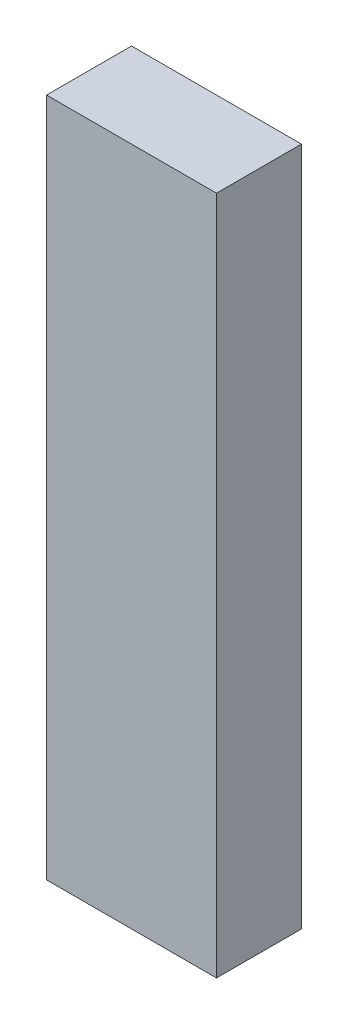
from build123d import *

# Parameters (mm, degrees)
SKETCH1_W           = 25.4
SKETCH1_H           = 12.7
BOSS_EXTRUDE1_DEPTH = 101.6


with BuildPart() as part:
    # Sketch1 → Boss-Extrude1 (new body)
    with BuildSketch(Plane(origin=(0, 0, 0), x_dir=(1, 0, 0), z_dir=(0, 1, 0))):
        with Locations((12.7, 6.35)):
            Rectangle(SKETCH1_W, SKETCH1_H)
    extrude(amount=BOSS_EXTRUDE1_DEPTH)


solid = part.part
